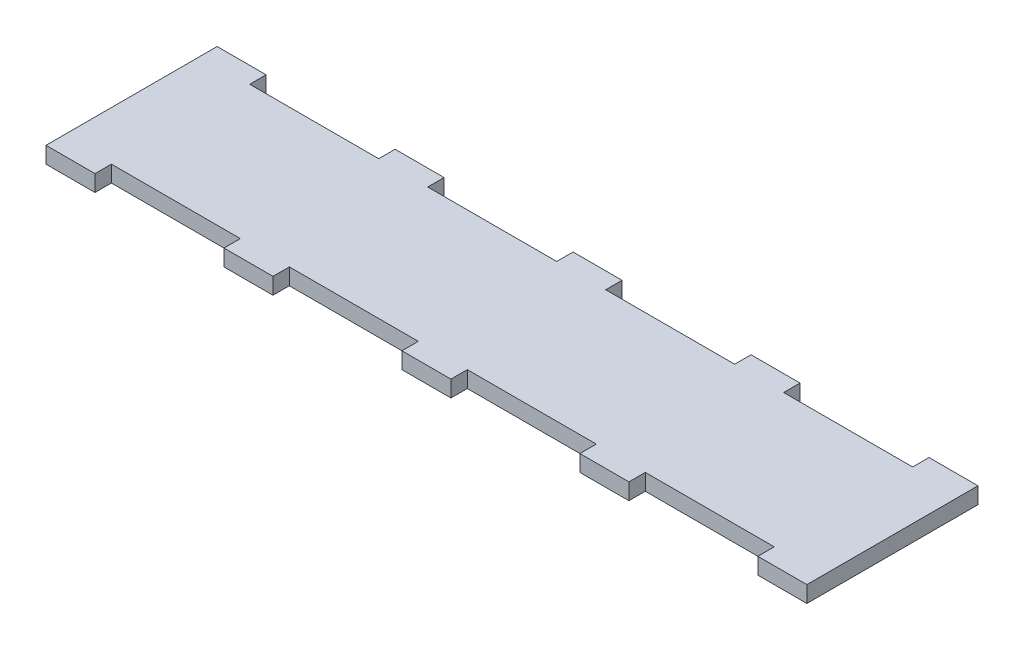
from build123d import *

# Parameters (mm, degrees)
BOSS_EXTRUDE1_DEPTH = 6.35


with BuildPart() as part:
    # Sketch1 → Boss-Extrude1 (new body)
    with BuildSketch(Plane(origin=(0, 0, 0), x_dir=(1, 0, 0), z_dir=(0, 1, 0))):
        Polygon((69, -53.65), (69, -60), (88, -60), (88, -53.65), (138, -53.65), (138, -60), (157, -60), (157, -53.65), (207, -53.65), (207, -60), (226, -60), (226, -53.65), (276, -53.65), (276, -60), (295, -60), (295, -53.65), (295, 0), (295, 6.35), (276, 6.35), (276, 0), (226, 0), (226, 6.35), (207, 6.35), (207, 0), (157, 0), (157, 6.35), (138, 6.35), (138, 0), (88, 0), (88, 6.35), (69, 6.35), (69, 0), (19, 0), (19, 6.35), (0, 6.35), (0, 0), (0, -53.65), (0, -60), (19, -60), (19, -53.65), align=None)
    extrude(amount=BOSS_EXTRUDE1_DEPTH)


solid = part.part
